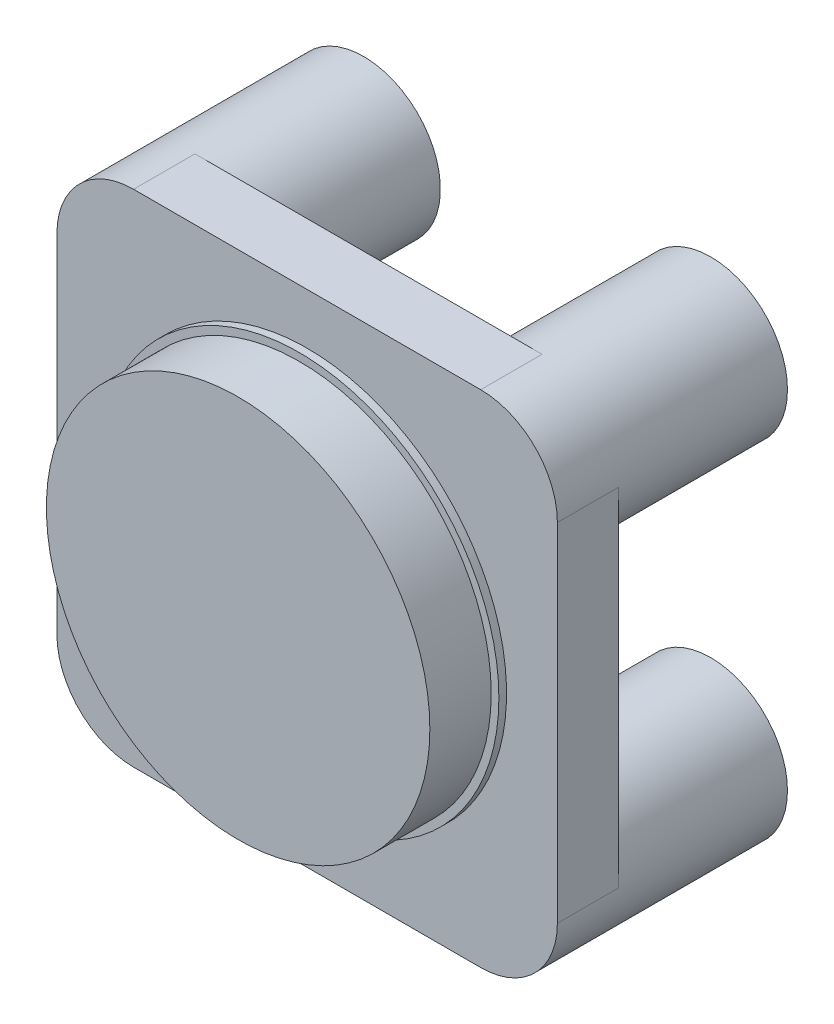
from build123d import *

# Parameters (mm, degrees)
SKETCH3_R             = 5
BOSS_EXTRUDE1_DEPTH   = 15
BOSS_EXTRUDE1_2_DEPTH = 15
BOSS_EXTRUDE1_3_DEPTH = 15
BOSS_EXTRUDE1_4_DEPTH = 15
SKETCH4_R             = 7.575
BOSS_EXTRUDE2_DEPTH   = 4
SKETCH5_R             = 12.5
BOSS_EXTRUDE3_DEPTH   = 4.5
SKETCH6_R             = 13
SKETCH6_R_2           = 12.5
BOSS_EXTRUDE4_DEPTH   = 0.5


with BuildPart() as part:
    # Sketch3 → Boss-Extrude1 (new body)
    with BuildSketch(Plane(origin=(0, 0, 19), x_dir=(-1, 0, 0), z_dir=(0, 0, -1))):
        with Locations((-11.313708499, 11.313708499)):
            Circle(SKETCH3_R)
    extrude(amount=BOSS_EXTRUDE1_DEPTH)



with BuildPart() as body_2:
    # Sketch3 → Boss-Extrude1 2 (new body)
    with BuildSketch(Plane(origin=(0, 0, 19), x_dir=(-1, 0, 0), z_dir=(0, 0, -1))):
        with Locations((11.313708499, 11.313708499)):
            Circle(SKETCH3_R)
    extrude(amount=BOSS_EXTRUDE1_2_DEPTH)


with BuildPart() as body_3:
    # Sketch3 → Boss-Extrude1 3 (new body)
    with BuildSketch(Plane(origin=(0, 0, 19), x_dir=(-1, 0, 0), z_dir=(0, 0, -1))):
        with Locations((11.313708499, -11.313708499)):
            Circle(SKETCH3_R)
    extrude(amount=BOSS_EXTRUDE1_3_DEPTH)


with BuildPart() as body_4:
    # Sketch3 → Boss-Extrude1 4 (new body)
    with BuildSketch(Plane(origin=(0, 0, 19), x_dir=(-1, 0, 0), z_dir=(0, 0, -1))):
        with Locations((-11.313708499, -11.313708499)):
            Circle(SKETCH3_R)
    extrude(amount=BOSS_EXTRUDE1_4_DEPTH)


with BuildPart() as part_1:
    add(part.part)

    add(body_2.part)  # Boss-Extrude2 merges body 2

    add(body_3.part)  # Boss-Extrude2 merges body 3

    add(body_4.part)  # Boss-Extrude2 merges body 4
    # Sketch4 → Boss-Extrude2 (add)
    with BuildSketch(Plane(origin=(0, 0, 19), x_dir=(-1, 0, 0), z_dir=(0, 0, -1))):
        with BuildLine():
            Line((16.313708499, -11.313708499), (16.313708499, 11.313708499))
            ThreePointArc((16.313708499, 11.313708499), (7.778174593, 7.778174593), (11.313708499, 16.313708499))
            Line((11.313708499, 16.313708499), (-11.313708499, 16.313708499))
            ThreePointArc((-11.313708499, 16.313708499), (-7.778174593, 14.849242405), (-6.313708499, 11.313708499))
            ThreePointArc((-6.313708499, 11.313708499), (-11.313708499, 6.313708499), (-16.313708499, 11.313708499))
            Line((-16.313708499, 11.313708499), (-16.313708499, -11.313708499))
            ThreePointArc((-16.313708499, -11.313708499), (-11.313708499, -6.313708499), (-6.313708499, -11.313708499))
            ThreePointArc((-6.313708499, -11.313708499), (-7.778174593, -14.849242405), (-11.313708499, -16.313708499))
            Line((-11.313708499, -16.313708499), (11.313708499, -16.313708499))
            ThreePointArc((11.313708499, -16.313708499), (7.778174593, -7.778174593), (16.313708499, -11.313708499))
        make_face()
        Circle(SKETCH4_R, mode=Mode.SUBTRACT)
    extrude(amount=BOSS_EXTRUDE2_DEPTH)

    # Sketch5 → Boss-Extrude3 (add)
    with BuildSketch(Plane.XY.offset(19)):
        with Locations(Location((0, 0, 0), (0, 0, 180))):
            Circle(SKETCH5_R)
    extrude(amount=BOSS_EXTRUDE3_DEPTH)

    # Sketch6 → Boss-Extrude4 (add)
    with BuildSketch(Plane.XY.offset(19)):
        with Locations(Location((0, 0, 0), (0, 0, 180))):
            Circle(SKETCH6_R)
        Circle(SKETCH6_R_2, mode=Mode.SUBTRACT)
    extrude(amount=BOSS_EXTRUDE4_DEPTH)


solid = part_1.part
